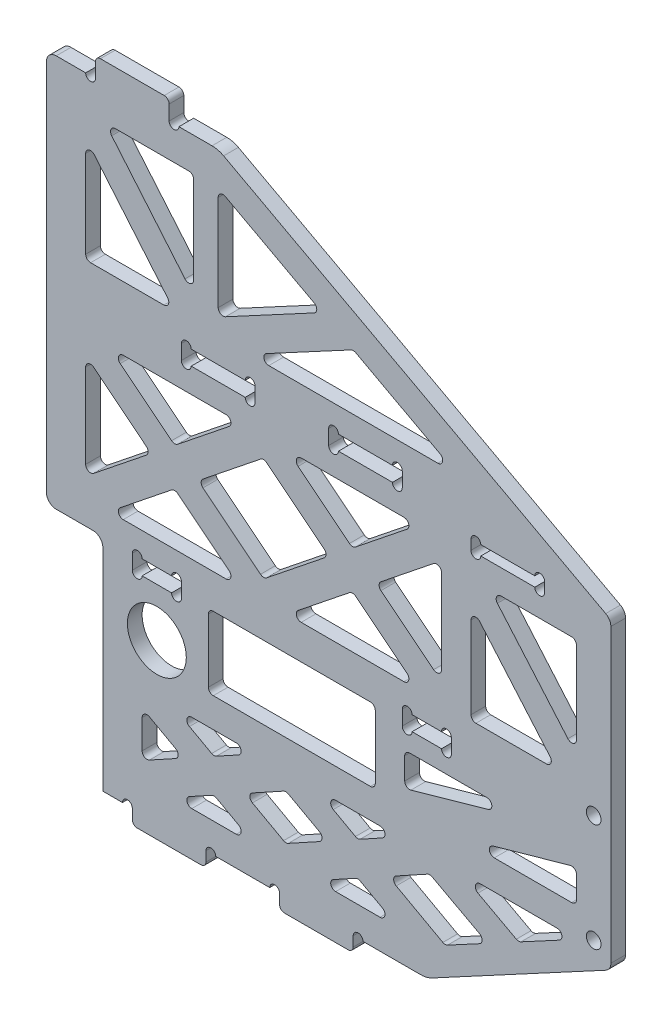
from build123d import *

# Parameters (mm, degrees)
SKETCH_1_R          = 1.5
SKETCH_1_W          = 10
SKETCH_1_H          = 3
SKETCH_1_W_2        = 15
SKETCH_1_H_2        = 2
EXTRUDE_1_DEPTH     = 3
SKETCH_3_R          = 6
SKETCH_3_W          = 35.000000003
SKETCH_3_H          = 9.891402238
SKETCH_3_W_2        = 22
SKETCH_3_H_2        = 26.188199577
SKETCH_3_W_3        = 72.5
SKETCH_3_H_3        = 29
SKETCH_3_W_4        = 21.500000003
SKETCH_3_H_4        = 25
SKETCH_3_W_5        = 34
SKETCH_3_H_5        = 14.891402238
CUT_EXTRUDE_2_DEPTH = 131.706732805
EXTRUDE_1_2_DEPTH   = 3
SKETCH_2_R          = 1
CUT_EXTRUDE_1_DEPTH = 131.706732805
FILLET_1_R          = 1
FILLET_2_R          = 2
FILLET_3_R          = 5


with BuildPart() as part:
    # 草图1 → Extrude 1 (new body)
    with BuildSketch(Plane.XY):
        Polygon((17.5, 83), (97.500000003, 40), (97.500000003, -21.8), (60, -42), (45, -42), (45, -45), (30, -45), (30, -42), (15, -42), (15, -45), (0, -45), (0, -42), (-6, -42), (-6, 3), (-17.5, 3), (-17.5, 83), (-7.5, 83), (-7.5, 87), (7.5, 87), (7.5, 83), align=None)
        with Locations((94.000000003, -18.3)):
            Circle(SKETCH_1_R, mode=Mode.SUBTRACT)
        with Locations((94.000000003, 3.699999819)):
            Circle(SKETCH_1_R, mode=Mode.SUBTRACT)
        with Locations((5, 1.5)):
            Rectangle(SKETCH_1_W, SKETCH_1_H, mode=Mode.SUBTRACT)
        with Locations((60, 1.5)):
            Rectangle(SKETCH_1_W, SKETCH_1_H, mode=Mode.SUBTRACT)
        with Locations((47.5, 43.5)):
            Rectangle(SKETCH_1_W_2, SKETCH_1_H, mode=Mode.SUBTRACT)
        with Locations((17.5, 43.5)):
            Rectangle(SKETCH_1_W_2, SKETCH_1_H, mode=Mode.SUBTRACT)
        with Locations((76.5, 39)):
            Rectangle(SKETCH_1_W_2, SKETCH_1_H_2, mode=Mode.SUBTRACT)
    extrude(amount=EXTRUDE_1_DEPTH)

    # 草图3 → 切除-拉伸2 (cut, through all)
    with BuildSketch(Plane.XY.offset(3)):
        with Locations((5, -9.891402238)):
            Circle(SKETCH_3_R)
        Polygon((17.5, 76.188199577), (17.5, 50), (66.222231774, 50), align=None)
        with Locations((73.000000002, -8.945701119)):
            Rectangle(SKETCH_3_W, SKETCH_3_H)
        with Locations((1.5, 63.094099789)):
            Rectangle(SKETCH_3_W_2, SKETCH_3_H_2)
        with Locations((26.75, 22.5)):
            Rectangle(SKETCH_3_W_3, SKETCH_3_H_3)
        with Locations((79.750000002, 20.5)):
            Rectangle(SKETCH_3_W_4, SKETCH_3_H_4)
        Polygon((2, -19.891402238), (90.500000003, -19.891402238), (60.595424948, -36), (2, -36), align=None)
        with Locations((32.5, -6.445701119)):
            Rectangle(SKETCH_3_W_5, SKETCH_3_H_5)
    extrude(amount=-CUT_EXTRUDE_2_DEPTH, mode=Mode.SUBTRACT)

    # 草图4 → Extrude 1 2 (add)
    with BuildSketch(Plane.XY.offset(3)):
        Polygon((-11.797031982, 74.258524975), (10.202968018, 48.070325397), (14.797031982, 51.929674603), (-7.202968018, 78.11787418), align=None)
        Polygon((18.92032934, 47.357526809), (46.449724494, 62.154576703), (43.609065813, 67.439523085), (16.07967066, 52.642473191), align=None)
        Polygon((-11.374085143, 34.657393572), (26.75, 4.158125458), (64.874085143, 34.657393572), (61.125914857, 39.342606428), (26.75, 11.841874542), (-7.625914857, 39.342606428), align=None)
        Polygon((64.874085143, 10.342606428), (26.75, 40.841874542), (-11.374085143, 10.342606428), (-7.625914857, 5.657393572), (26.75, 33.158125458), (61.125914857, 5.657393572), align=None)
        Polygon((92.774555592, 9.956117807), (71.274555589, 34.956117807), (66.725444411, 31.043882193), (88.225444415, 6.043882193), align=None)
        Polygon((0.554598138, -22.520244846), (31.297712474, -39.423559848), (60.61012529, -23.306879479), (74.124993019, -30.586888229), (76.766180129, -32.009607685), (79.611619042, -26.727233466), (76.970431932, -25.304514009), (60.580724606, -16.475924997), (31.297712474, -32.576440152), (3.445401862, -17.26255963), align=None)
        Polygon((64.669669418, -34.816559254), (62.04082681, -33.371157392), (31.297712474, -16.46784239), (0.554598138, -33.371157392), (3.445401862, -38.628842608), (31.297712474, -23.314962086), (59.150023086, -38.628842608), (61.778865695, -40.07424447), align=None)
        Polygon((56.315878493, -16.778328335), (91.315878496, -6.886926096), (89.684121511, -1.113073904), (54.684121507, -11.004476142), align=None)
    extrude(amount=-EXTRUDE_1_2_DEPTH)

    # 草图2 → 切除-拉伸1 (cut, through all)
    with BuildSketch(Plane.XY.offset(3)):
        with Locations((-8.5, 83)):
            Circle(SKETCH_2_R)
        with Locations((8.5, 83)):
            Circle(SKETCH_2_R)
        with Locations((11, 45)):
            Circle(SKETCH_2_R)
        with Locations((24, 45)):
            Circle(SKETCH_2_R)
        with Locations((11, 42)):
            Circle(SKETCH_2_R)
        with Locations((24, 42)):
            Circle(SKETCH_2_R)
        with Locations((41, 45)):
            Circle(SKETCH_2_R)
        with Locations((41, 42)):
            Circle(SKETCH_2_R)
        with Locations((54, 45)):
            Circle(SKETCH_2_R)
        with Locations((54, 42)):
            Circle(SKETCH_2_R)
        with Locations((1, 3)):
            Circle(SKETCH_2_R)
        with Locations((1, 0)):
            Circle(SKETCH_2_R)
        with Locations((9, 3)):
            Circle(SKETCH_2_R)
        with Locations((9, 0)):
            Circle(SKETCH_2_R)
        with Locations((56, 3)):
            Circle(SKETCH_2_R)
        with Locations((56, 0)):
            Circle(SKETCH_2_R)
        with Locations((64, 3)):
            Circle(SKETCH_2_R)
        with Locations((64, 0)):
            Circle(SKETCH_2_R)
        with Locations((-1, -42)):
            Circle(SKETCH_2_R)
        with Locations((16, -42)):
            Circle(SKETCH_2_R)
        with Locations((29, -42)):
            Circle(SKETCH_2_R)
        with Locations((46, -42)):
            Circle(SKETCH_2_R)
        with BuildLine():
            Line((69, 38), (71, 38))
            ThreePointArc((71, 38), (70, 37), (69, 38))
        make_face()
        with BuildLine():
            Line((84, 40), (82, 40))
            ThreePointArc((82, 40), (83, 41), (84, 40))
        make_face()
        with BuildLine():
            Line((71, 40), (69, 40))
            ThreePointArc((69, 40), (70, 41), (71, 40))
        make_face()
        with BuildLine():
            Line((82, 38), (84, 38))
            ThreePointArc((84, 38), (83, 37), (82, 38))
        make_face()
    extrude(amount=-CUT_EXTRUDE_1_DEPTH, mode=Mode.SUBTRACT)

    # 圆角1
    fillet_1_edges = [part.edges().sort_by_distance(p)[0] for p in [
        (90.500000003, -19.891402238, 1.5),
        (69, 8, 1.5),
        (90.500000003, 33, 1.5),
        (-9.5, 50, 1.5),
        (12.5, 76.188199577, 1.5),
        (15.5, -13.891402238, 1.5),
        (15.5, 1, 1.5),
        (49.5, 1, 1.5),
        (49.5, -13.891402238, 1.5),
        (55.5, -4, 1.5),
        (90.500000003, -13.891402238, 1.5),
        (17.5, 76.188199577, 1.5),
        (66.222231774, 50, 1.5),
        (8.58190044, 50, 1.5),
        (12.5, 54.663998784, 1.5),
        (-5.58190044, 76.188199577, 1.5),
        (-9.5, 71.524200793, 1.5),
        (17.5, 53.405900211, 1.5),
        (23.836558533, 50, 1.5),
        (45.029395153, 61.391149683, 1.5),
        (38.69283662, 64.797049894, 1.5),
        (31.552343178, 8, 1.5),
        (21.947656822, 8, 1.5),
        (-4.697656822, 8, 1.5),
        (58.197656822, 8, 1.5),
        (63, 33.158125458, 1.5),
        (63, 11.841874542, 1.5),
        (-4.697656822, 37, 1.5),
        (58.197656822, 37, 1.5),
        (31.552343178, 37, 1.5),
        (21.947656822, 37, 1.5),
        (-9.5, 33.158125458, 1.5),
        (-9.5, 11.841874542, 1.5),
        (-7.5, 87, 1.5),
        (7.5, 87, 1.5),
        (45, -45, 1.5),
        (30, -45, 1.5),
        (15, -45, 1.5),
        (0, -45, 1.5),
        (3.822656822, 22.5, 1.5),
        (8.625, 26.341874542, 1.5),
        (44.875, 26.341874542, 1.5),
        (49.677343178, 22.5, 1.5),
        (44.875, 18.658125458, 1.5),
        (8.625, 18.658125458, 1.5),
        (26.75, 33.158125458, 1.5),
        (13.427343178, 22.5, 1.5),
        (40.072656822, 22.5, 1.5),
        (26.75, 11.841874542, 1.5),
        (86.543183101, 8, 1.5),
        (90.500000003, 12.600949886, 1.5),
        (72.956816903, 33, 1.5),
        (69, 28.399050114, 1.5),
        (66.531054354, -13.891402238, 1.5),
        (79.46894565, -4, 1.5),
        (55.5, -10.773899504, 1.5),
        (90.500000003, -7.117502735, 1.5),
        (54.368782906, -36, 1.5),
        (8.226642042, -36, 1.5),
        (25.071070432, -36, 1.5),
        (37.524354516, -36, 1.5),
        (63.740659568, -34.305766952, 1.5),
        (72.384755801, -29.649480448, 1.5),
        (78.71066915, -26.241921791, 1.5),
        (37.524354516, -19.891402238, 1.5),
        (25.071070432, -19.891402238, 1.5),
        (54.368782906, -19.891402238, 1.5),
        (8.226642042, -19.891402238, 1.5),
        (2, -32.576440152, 1.5),
        (2, -23.314962086, 1.5),
        (10.422214195, -27.945701119, 1.5),
        (16.648856237, -24.522141271, 1.5),
        (45.946568711, -24.522141271, 1.5),
        (66.921338297, -19.891402238, 1.5),
        (16.648856237, -31.369260967, 1.5),
        (45.946568711, -31.369260967, 1.5),
        (22.875498279, -27.945701119, 1.5),
        (39.719926669, -27.945701119, 1.5),
        (31.297712474, -32.576440152, 1.5),
        (52.173210753, -27.945701119, 1.5),
        (60.61012529, -23.306879479, 1.5),
        (31.297712474, -23.314962086, 1.5),
    ]]
    fillet(fillet_1_edges, radius=FILLET_1_R)

    # 圆角2
    fillet_2_edges = [part.edges().sort_by_distance(p)[0] for p in [
        (-17.5, 83, 1.5),
        (97.500000003, 40, 1.5),
        (97.500000003, -21.8, 1.5),
        (-6, 3, 1.5),
        (-17.5, 3, 1.5),
    ]]
    fillet(fillet_2_edges, radius=FILLET_2_R)

    # 圆角3
    fillet_3_edges = [part.edges().sort_by_distance(p)[0] for p in [
        (17.5, 83, 1.5),
        (60, -42, 1.5),
    ]]
    fillet(fillet_3_edges, radius=FILLET_3_R)


solid = part.part
